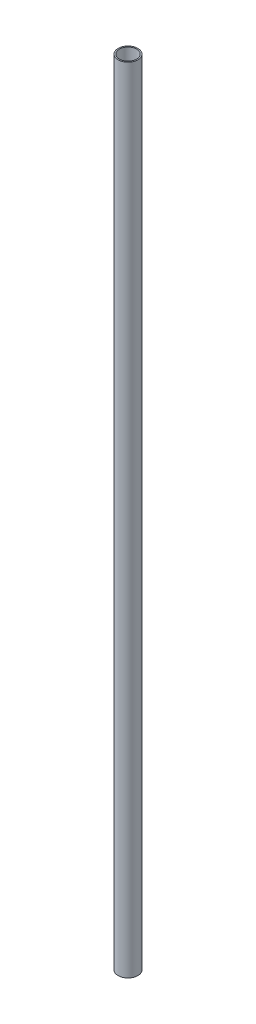
from build123d import *

# Parameters (mm, degrees)
SKETCH_1_R      = 8
SKETCH_1_R_2    = 7
EXTRUDE_1_DEPTH = 641


with BuildPart() as part:
    # 草图1 → 凸台-拉伸1 (new body)
    with BuildSketch(Plane(origin=(0, 0, 0), x_dir=(1, 0, 0), z_dir=(0, 1, 0))):
        with Locations(Location((0, 0, 0), (0, 0, 270))):
            Circle(SKETCH_1_R)
        with Locations(Location((0, 0, 0), (0, 0, 270))):
            Circle(SKETCH_1_R_2, mode=Mode.SUBTRACT)
    extrude(amount=EXTRUDE_1_DEPTH)


solid = part.part
